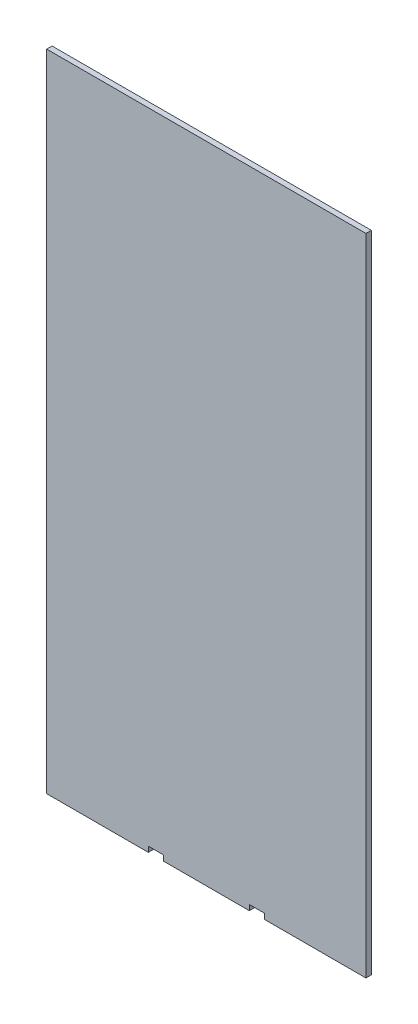
from build123d import *

# Parameters (mm, degrees)
SKETCH1_W          = 297
SKETCH1_H          = 600
EXTRUDE1_DEPTH     = 5
CUT_EXTRUDE1_REACH = 626.921
SKETCH2_W          = 14
SKETCH2_H          = 5


with BuildPart() as part:
    # Sketch1 → Extrude1 (new body)
    with BuildSketch(Plane.XY):
        with Locations((0, -307)):
            Rectangle(SKETCH1_W, SKETCH1_H)
    extrude(amount=-EXTRUDE1_DEPTH)

    # Sketch2 → Cut-Extrude1 (cut, up to next)
    with BuildSketch(Plane(origin=(0, 0, -5), x_dir=(-1, 0, 0), z_dir=(0, 0, -1)), mode=Mode.PRIVATE) as cut_extrude1_sk1:
        with Locations((-47, -604.5)):
            Rectangle(SKETCH2_W, SKETCH2_H)
    cut_extrude1_tool1 = extrude(cut_extrude1_sk1.sketch, amount=-CUT_EXTRUDE1_REACH, mode=Mode.PRIVATE) & part.part
    # Sketch2 → Cut-Extrude1 (cut, up to next)
    with BuildSketch(Plane(origin=(0, 0, -5), x_dir=(-1, 0, 0), z_dir=(0, 0, -1)), mode=Mode.PRIVATE) as cut_extrude1_sk2:
        with Locations((47, -604.5)):
            Rectangle(SKETCH2_W, SKETCH2_H)
    cut_extrude1_tool2 = extrude(cut_extrude1_sk2.sketch, amount=-CUT_EXTRUDE1_REACH, mode=Mode.PRIVATE) & part.part
    add(cut_extrude1_tool1.solids().sort_by_distance((47, -604.5, -5))[0], mode=Mode.SUBTRACT)
    add(cut_extrude1_tool2.solids().sort_by_distance((-47, -604.5, -5))[0], mode=Mode.SUBTRACT)


solid = part.part
